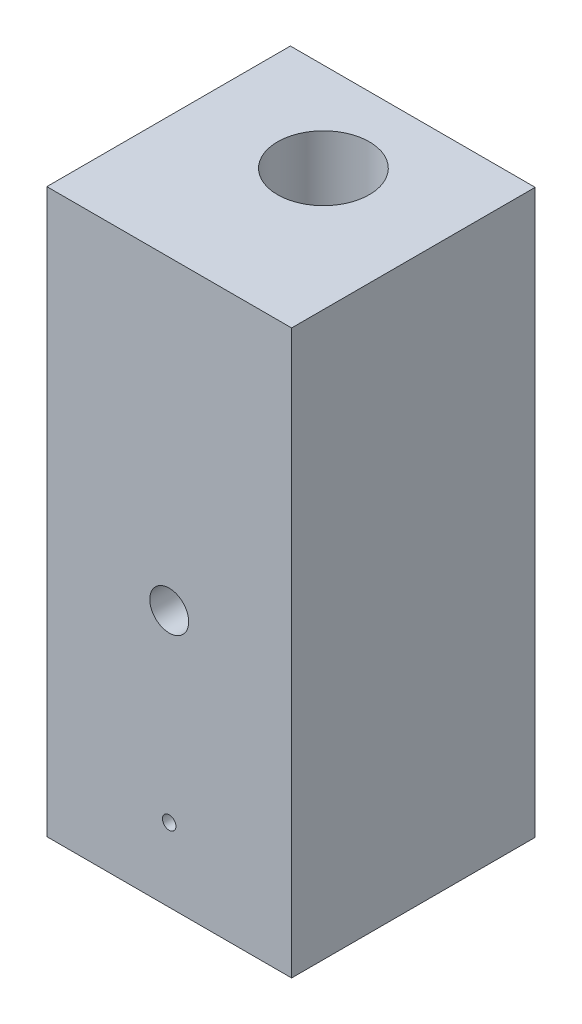
from build123d import *

# Parameters (mm, degrees)
SKETCH1_W                        = 25.4
SKETCH1_H                        = 25.273
BOSS_EXTRUDE1_DEPTH              = 58.42
F_54_0_055_DIAMETER_HOLE1_D      = 1.397
F_54_0_055_DIAMETER_HOLE1_DEPTH  = 12.7
F_54_0_055_DIAMETER_HOLE1_TIP    = 0.419701142
F_3_8_0_375_DIAMETER_HOLE2_D     = 9.525
F_3_8_0_375_DIAMETER_HOLE2_DEPTH = 50.8
F_3_8_0_375_DIAMETER_HOLE2_TIP   = 2.861598698
F_10_32_TAPPED_HOLE1_D           = 4.0386
F_10_32_TAPPED_HOLE1_DEPTH       = 8.946682152
F_10_32_TAPPED_HOLE1_TIP         = 1.213317848


with BuildPart() as part:
    # Sketch1 → Boss-Extrude1 (new body)
    with BuildSketch(Plane(origin=(0, 0, 0), x_dir=(1, 0, 0), z_dir=(0, 1, 0))):
        with Locations((-12.7, 12.6365)):
            Rectangle(SKETCH1_W, SKETCH1_H)
    extrude(amount=BOSS_EXTRUDE1_DEPTH)

    # #54 (0.055) Diameter Hole1
    with Locations(Plane(origin=(-12.7, 7.62, 0), x_dir=(1, 0, 0), z_dir=(0, 0, 1))):
        with Locations((0, 0)):
            Hole(F_54_0_055_DIAMETER_HOLE1_D / 2, depth=F_54_0_055_DIAMETER_HOLE1_DEPTH)
            with Locations((0, 0, -(F_54_0_055_DIAMETER_HOLE1_DEPTH + F_54_0_055_DIAMETER_HOLE1_TIP / 2))):  # 118° drill point
                Cone(0, F_54_0_055_DIAMETER_HOLE1_D / 2, F_54_0_055_DIAMETER_HOLE1_TIP, mode=Mode.SUBTRACT)

    # 3/8 (0.375) Diameter Hole2
    with Locations(Plane(origin=(-12.7, 58.42, -16.002), x_dir=(0, 0, 1), z_dir=(0, 1, 0))):
        with Locations((0, 0)):
            Hole(F_3_8_0_375_DIAMETER_HOLE2_D / 2, depth=F_3_8_0_375_DIAMETER_HOLE2_DEPTH)
            with Locations((0, 0, -(F_3_8_0_375_DIAMETER_HOLE2_DEPTH + F_3_8_0_375_DIAMETER_HOLE2_TIP / 2))):  # 118° drill point
                Cone(0, F_3_8_0_375_DIAMETER_HOLE2_D / 2, F_3_8_0_375_DIAMETER_HOLE2_TIP, mode=Mode.SUBTRACT)

    # #10-32 Tapped Hole1
    with Locations(Plane(origin=(-12.7, 26.67, 0), x_dir=(1, 0, 0), z_dir=(0, 0, 1))):
        with Locations((0, 0)):
            Hole(F_10_32_TAPPED_HOLE1_D / 2, depth=F_10_32_TAPPED_HOLE1_DEPTH)
            with Locations((0, 0, -(F_10_32_TAPPED_HOLE1_DEPTH + F_10_32_TAPPED_HOLE1_TIP / 2))):  # 118° drill point
                Cone(0, F_10_32_TAPPED_HOLE1_D / 2, F_10_32_TAPPED_HOLE1_TIP, mode=Mode.SUBTRACT)


solid = part.part
